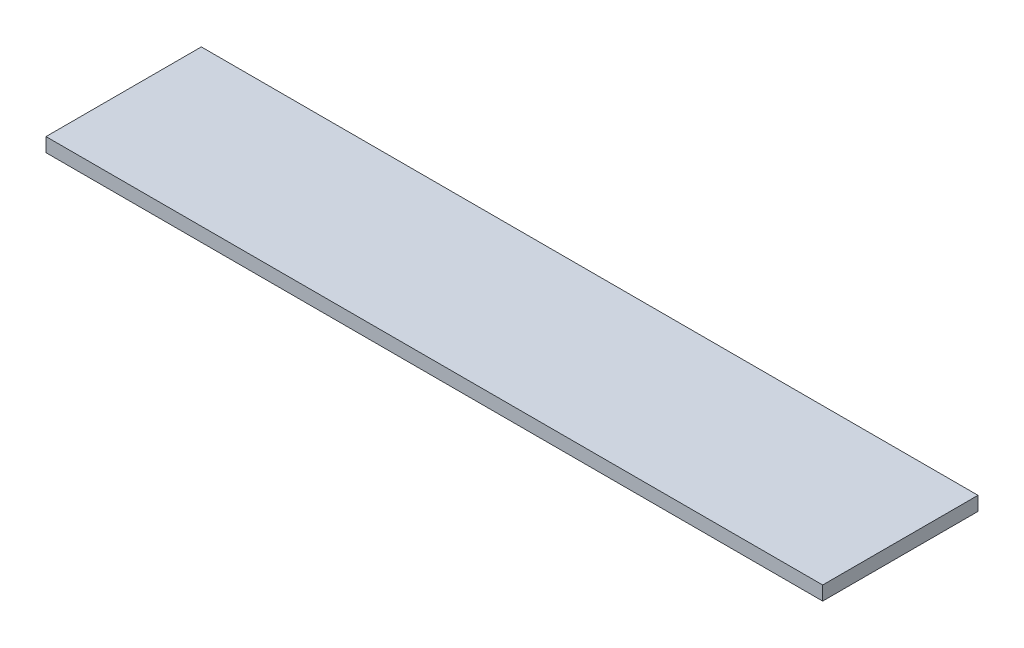
from build123d import *

# Parameters (mm, degrees)
ESQUISSE1_W        = 1000
ESQUISSE1_H        = 200
BOSS_EXTRU_1_DEPTH = 18


with BuildPart() as part:
    # Esquisse1 → Boss.-Extru.1 (new body)
    with BuildSketch(Plane(origin=(0, 0, 0), x_dir=(1, 0, 0), z_dir=(0, 1, 0))):
        Rectangle(ESQUISSE1_W, ESQUISSE1_H)
    extrude(amount=BOSS_EXTRU_1_DEPTH)


solid = part.part
